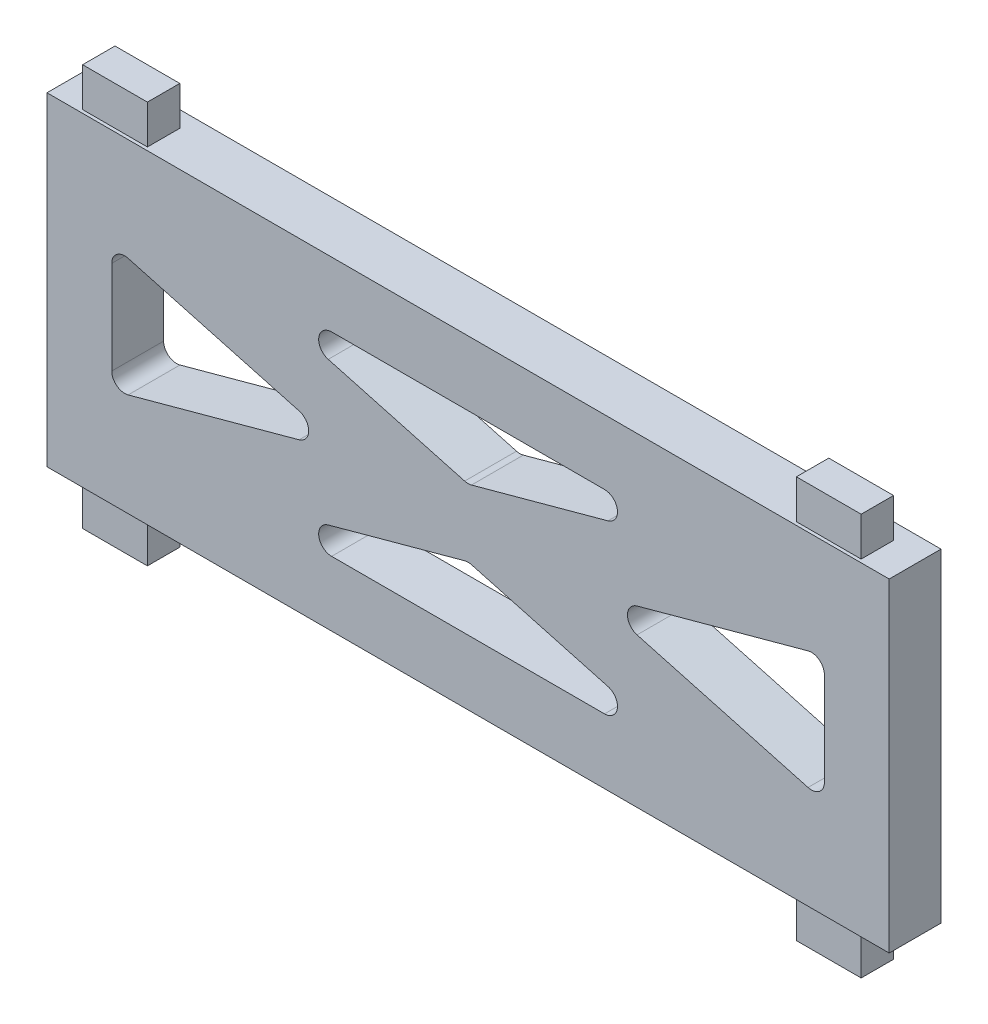
from build123d import *

# Parameters (mm, degrees)
SKETCH1_W             = 10
SKETCH1_H             = 5
BOSS_EXTRUDE1_DEPTH   = 6
BOSS_EXTRUDE1_2_DEPTH = 6
SKETCH2_W             = 130
SKETCH2_H             = 8
BOSS_EXTRUDE2_DEPTH   = 50
SKETCH3_W             = 10
SKETCH3_H             = 5
BOSS_EXTRUDE3_DEPTH   = 6
CUT_EXTRUDE1_DEPTH    = 118.155500326


with BuildPart() as part:
    # Sketch1 → Boss-Extrude1 (new body)
    with BuildSketch(Plane(origin=(0, 0, 0), x_dir=(1, 0, 0), z_dir=(0, 1, 0))):
        with Locations((21.089936581, -35.391183382)):
            Rectangle(SKETCH1_W, SKETCH1_H)
    extrude(amount=BOSS_EXTRUDE1_DEPTH)



with BuildPart() as body_2:
    # Sketch1 → Boss-Extrude1 2 (new body)
    with BuildSketch(Plane(origin=(0, 0, 0), x_dir=(1, 0, 0), z_dir=(0, 1, 0))):
        with Locations((-89.082850467, -35.391183382)):
            Rectangle(SKETCH1_W, SKETCH1_H)
    extrude(amount=BOSS_EXTRUDE1_2_DEPTH)


with BuildPart() as part_1:
    add(part.part)

    add(body_2.part)  # Boss-Extrude2 merges body 2
    # Sketch2 → Boss-Extrude2 (add)
    with BuildSketch(Plane(origin=(0, 6, 0), x_dir=(1, 0, 0), z_dir=(0, 1, 0))):
        with Locations((-34.082850467, -34.391183382)):
            Rectangle(SKETCH2_W, SKETCH2_H)
    extrude(amount=BOSS_EXTRUDE2_DEPTH)

    # Sketch3 → Boss-Extrude3 (add)
    with BuildSketch(Plane(origin=(0, 56, 0), x_dir=(1, 0, 0), z_dir=(0, 1, 0))):
        with Locations((-89.082850467, -35.391183382)):
            Rectangle(SKETCH3_W, SKETCH3_H)
        with Locations((21.089936581, -35.391183382)):
            Rectangle(SKETCH3_W, SKETCH3_H)
    extrude(amount=BOSS_EXTRUDE3_DEPTH)

    # Sketch4 → Cut-Extrude1 (cut, through all)
    with BuildSketch(Plane.XY.offset(38.391183382)):
        with BuildLine():
            Line((-13.020277053, 46), (-55.145423882, 46))
            ThreePointArc((-55.145423882, 46), (-57.127727502, 44.265466302), (-55.671658693, 42.070472358))
            Line((-55.671658693, 42.070472358), (-34.609085279, 36.326134154))
            ThreePointArc((-34.609085279, 36.326134154), (-34.082850467, 36.255661796), (-33.556615656, 36.326134154))
            Line((-33.556615656, 36.326134154), (-12.494042241, 42.070472358))
            ThreePointArc((-12.494042241, 42.070472358), (-11.037973433, 44.265466302), (-13.020277053, 46))
        make_face()
        with BuildLine():
            Line((-89.082850467, 38.198883658), (-89.082850467, 23.801116342))
            ThreePointArc((-89.082850467, 23.801116342), (-88.296837777, 22.211702987), (-86.556615656, 21.871588699))
            Line((-86.556615656, 21.871588699), (-60.160708908, 29.070472358))
            ThreePointArc((-60.160708908, 29.070472358), (-58.68694372, 31), (-60.160708908, 32.929527642))
            Line((-60.160708908, 32.929527642), (-86.556615656, 40.128411301))
            ThreePointArc((-86.556615656, 40.128411301), (-88.296837777, 39.788297013), (-89.082850467, 38.198883658))
        make_face()
        with BuildLine():
            Line((-55.145423882, 16), (-13.020277053, 16))
            ThreePointArc((-13.020277053, 16), (-11.037973433, 17.734533698), (-12.494042241, 19.929527642))
            Line((-12.494042241, 19.929527642), (-33.556615656, 25.673865846))
            ThreePointArc((-33.556615656, 25.673865846), (-34.082850467, 25.744338204), (-34.609085279, 25.673865846))
            Line((-34.609085279, 25.673865846), (-55.671658693, 19.929527642))
            ThreePointArc((-55.671658693, 19.929527642), (-57.127727502, 17.734533698), (-55.145423882, 16))
        make_face()
        with BuildLine():
            Line((20.917149533, 23.801116342), (20.917149533, 38.198883658))
            ThreePointArc((20.917149533, 38.198883658), (20.131136843, 39.788297013), (18.390914721, 40.128411301))
            Line((18.390914721, 40.128411301), (-8.004992027, 32.929527642))
            ThreePointArc((-8.004992027, 32.929527642), (-9.478757215, 31), (-8.004992027, 29.070472358))
            Line((-8.004992027, 29.070472358), (18.390914721, 21.871588699))
            ThreePointArc((18.390914721, 21.871588699), (20.131136843, 22.211702987), (20.917149533, 23.801116342))
        make_face()
    extrude(amount=-CUT_EXTRUDE1_DEPTH, mode=Mode.SUBTRACT)


solid = part_1.part
